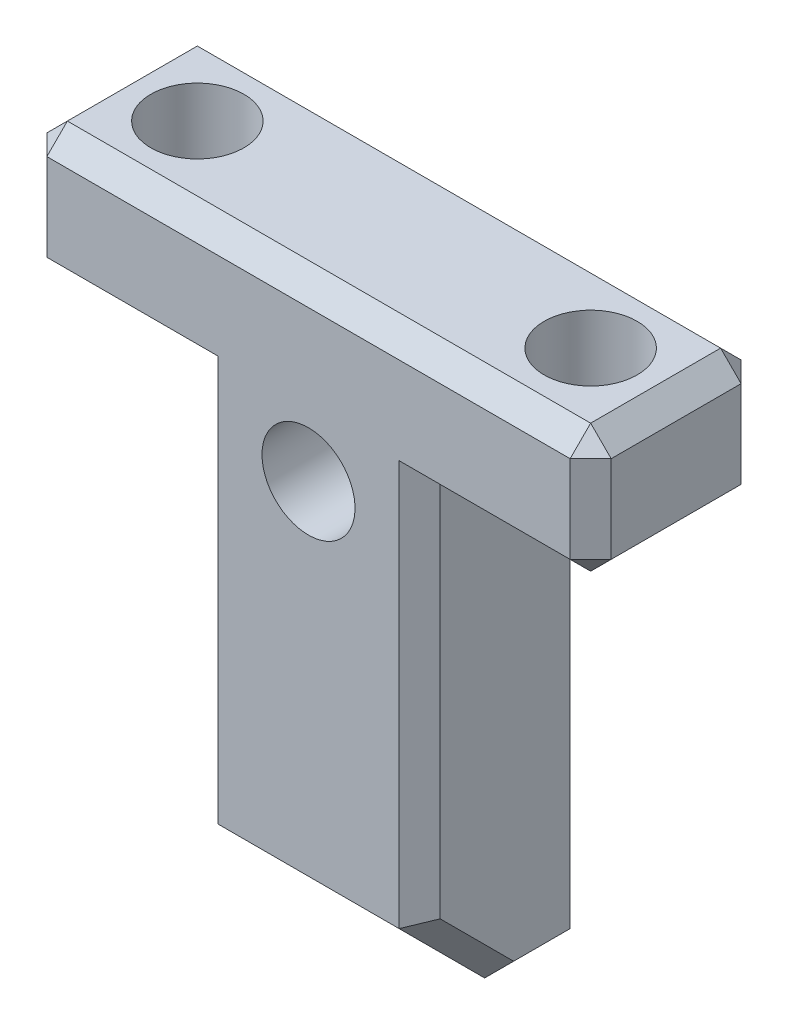
from build123d import *

# Parameters (mm, degrees)
SKETCH1_W             = 8.255
SKETCH1_H             = 22.225
BOSS_EXTRUDE1_DEPTH   = 6.35
SKETCH2_W             = 6.35
SKETCH2_H             = 4.7625
BOSS_EXTRUDE2_DEPTH   = 6.35
BOSS_EXTRUDE3_START   = -8.255
SKETCH2_4_W           = 6.35
SKETCH2_4_H           = 4.7625
BOSS_EXTRUDE3_DEPTH   = 6.35
F_4_CLEARANCE_HOLE1_D = 3.4544
F_4_CLEARANCE_HOLE2_D = 3.4544
CHAMFER1_SIZE         = 3.175
CHAMFER2_SIZE         = 0.762


with BuildPart() as part:
    # Sketch1 → Boss-Extrude1 (new body)
    with BuildSketch(Plane.XY):
        with Locations((-55.673222486, -11.1125)):
            Rectangle(SKETCH1_W, SKETCH1_H)
    extrude(amount=BOSS_EXTRUDE1_DEPTH)

    # Sketch2 → Boss-Extrude2 (add)
    with BuildSketch(Plane.ZY.offset(59.800722486)):
        with Locations((3.175, -2.38125)):
            Rectangle(SKETCH2_W, SKETCH2_H)
    extrude(amount=BOSS_EXTRUDE2_DEPTH)

    # Sketch2<4> → Boss-Extrude3 (add)
    with BuildSketch(Plane.ZY.offset(59.800722486).offset(BOSS_EXTRUDE3_START)):
        with Locations((3.175, -2.38125)):
            Rectangle(SKETCH2_4_W, SKETCH2_4_H)
    extrude(amount=-BOSS_EXTRUDE3_DEPTH)

    # #4 Clearance Hole1 (through all)
    with Locations(Plane(origin=(0, 0, 0), x_dir=(-1, 0, 0), z_dir=(0, 0, -1))):
        with Locations((55.673222486, -6.35)):
            Hole(F_4_CLEARANCE_HOLE1_D / 2)

    # Sketch6 → Hole1 (revolve, cut)
    with BuildSketch(Plane(origin=(-55.673222486, -6.35, 0), x_dir=(0, 1, 0), z_dir=(1, 0, 0))):
        Polygon((0, 0), (0, 3.429), (1.9431, 3.429), (2.0701, 0), align=None)
    revolve(axis=Axis((-55.673222486, -6.35, 110), (0, 0, -1)), mode=Mode.SUBTRACT)

    # #4 Clearance Hole2 (through all)
    with Locations(Plane(origin=(0, -4.7625, 0), x_dir=(-1, 0, 0), z_dir=(0, -1, 0))):
        with Locations((48.370722486, -3.175), (62.975722486, -3.175)):
            Hole(F_4_CLEARANCE_HOLE2_D / 2)

    # Chamfer1
    chamfer1_edges = [part.edges().sort_by_distance(p)[0] for p in [
        (-55.673222486, -22.225, 6.35),
    ]]
    chamfer(chamfer1_edges, length=CHAMFER1_SIZE)

    # Chamfer2
    chamfer2_edges = [part.edges().sort_by_distance(p)[0] for p in [
        (-59.800722486, -13.49375, 0),
        (-59.800722486, -11.90625, 6.35),
        (-62.975722486, -4.7625, 6.35),
        (-62.975722486, -4.7625, 0),
        (-66.150722486, -2.38125, 6.35),
        (-55.673222486, 0, 6.35),
        (-66.150722486, 0, 3.175),
        (-66.150722486, -2.38125, 0),
        (-66.150722486, -4.7625, 3.175),
        (-45.195722486, -2.38125, 0),
        (-48.370722486, -4.7625, 0),
        (-45.195722486, 0, 3.175),
        (-48.370722486, -4.7625, 6.35),
        (-45.195722486, -2.38125, 6.35),
        (-45.195722486, -4.7625, 3.175),
        (-55.673222486, 0, 0),
        (-51.545722486, -13.49375, 0),
        (-51.545722486, -11.90625, 6.35),
        (-51.545722486, -22.225, 1.5875),
        (-51.545722486, -20.6375, 4.7625),
        (-59.800722486, -22.225, 1.5875),
        (-59.800722486, -20.6375, 4.7625),
    ]]
    chamfer(chamfer2_edges, length=CHAMFER2_SIZE)


solid = part.part
